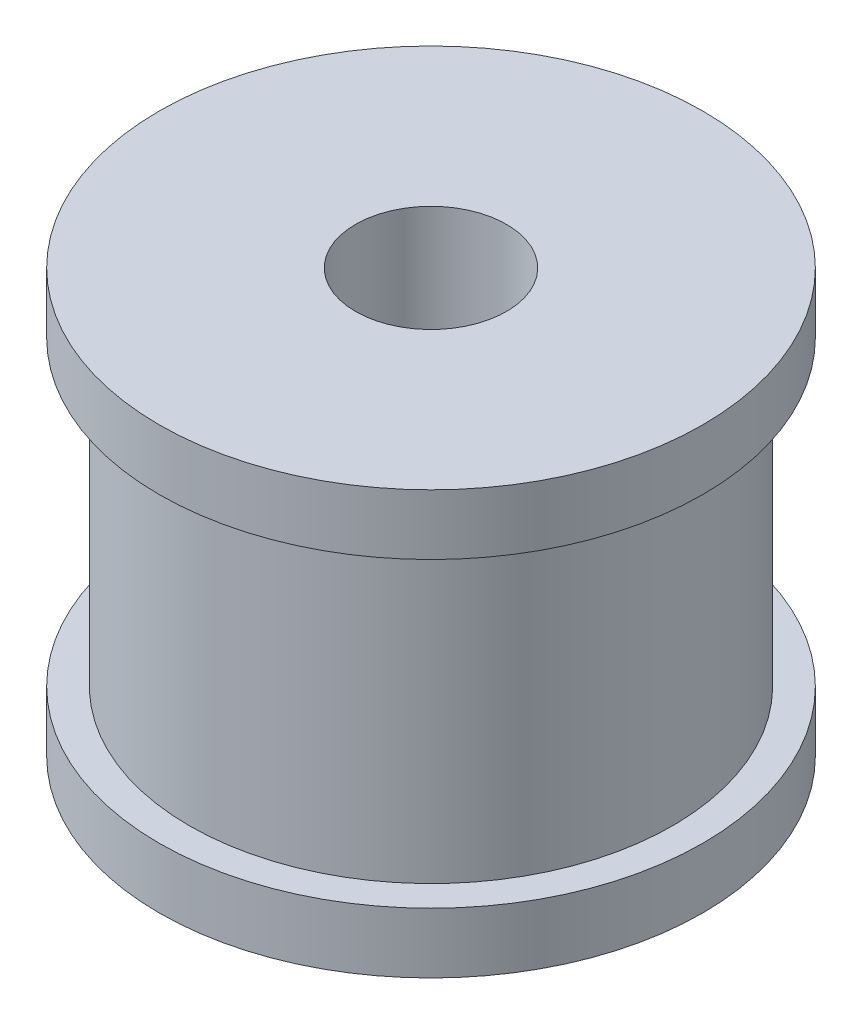
from build123d import *

# Parameters (mm, degrees)
SKETCH_1_R      = 8
SKETCH_1_R_2    = 2.5
EXTRUDE_1_DEPTH = 10
EXTRUDE_START   = -2
SKETCH_1_3_R    = 9
SKETCH_1_3_R_2  = 8
SKETCH_1_3_R_3  = 2.5
EXTRUDE_2_DEPTH = 2
EXTRUDE_START_2 = 10
SKETCH_1_4_R    = 9
SKETCH_1_4_R_2  = 8
SKETCH_1_4_R_3  = 2.5
EXTRUDE_3_DEPTH = 2


with BuildPart() as part:
    # 草图1 → 凸台-拉伸1 (new body)
    with BuildSketch(Plane(origin=(0, 0, 0), x_dir=(1, 0, 0), z_dir=(0, 1, 0))):
        with Locations(Location((0, 0, 0), (0, 0, 270))):
            Circle(SKETCH_1_R)
        with Locations(Location((0, 0, 0), (0, 0, 270))):
            Circle(SKETCH_1_R_2, mode=Mode.SUBTRACT)
    extrude(amount=EXTRUDE_1_DEPTH)

    # 草图1<3> → 凸台-拉伸2 (add)
    # profile 1 of 2: a face of its own
    with BuildSketch(Plane(origin=(0, 0, 0), x_dir=(1, 0, 0), z_dir=(0, 1, 0)).offset(EXTRUDE_START)):
        with Locations(Location((0, 0, 0), (0, 0, 270))):
            Circle(SKETCH_1_3_R)
        with Locations(Location((0, 0, 0), (0, 0, 270))):
            Circle(SKETCH_1_3_R_2, mode=Mode.SUBTRACT)
    # profile 2 of 2: a face of its own
    with BuildSketch(Plane(origin=(0, 0, 0), x_dir=(1, 0, 0), z_dir=(0, 1, 0)).offset(EXTRUDE_START)):
        with Locations(Location((0, 0, 0), (0, 0, 270))):
            Circle(SKETCH_1_3_R_2)
        with Locations(Location((0, 0, 0), (0, 0, 270))):
            Circle(SKETCH_1_3_R_3, mode=Mode.SUBTRACT)
    extrude(amount=EXTRUDE_2_DEPTH)

    # 草图1<4> → 凸台-拉伸3 (add)
    # profile 1 of 2: a face of its own
    with BuildSketch(Plane(origin=(0, 0, 0), x_dir=(1, 0, 0), z_dir=(0, 1, 0)).offset(EXTRUDE_START_2)):
        with Locations(Location((0, 0, 0), (0, 0, 270))):
            Circle(SKETCH_1_4_R)
        with Locations(Location((0, 0, 0), (0, 0, 270))):
            Circle(SKETCH_1_4_R_2, mode=Mode.SUBTRACT)
    # profile 2 of 2: a face of its own
    with BuildSketch(Plane(origin=(0, 0, 0), x_dir=(1, 0, 0), z_dir=(0, 1, 0)).offset(EXTRUDE_START_2)):
        with Locations(Location((0, 0, 0), (0, 0, 270))):
            Circle(SKETCH_1_4_R_2)
        with Locations(Location((0, 0, 0), (0, 0, 270))):
            Circle(SKETCH_1_4_R_3, mode=Mode.SUBTRACT)
    extrude(amount=EXTRUDE_3_DEPTH)


solid = part.part
